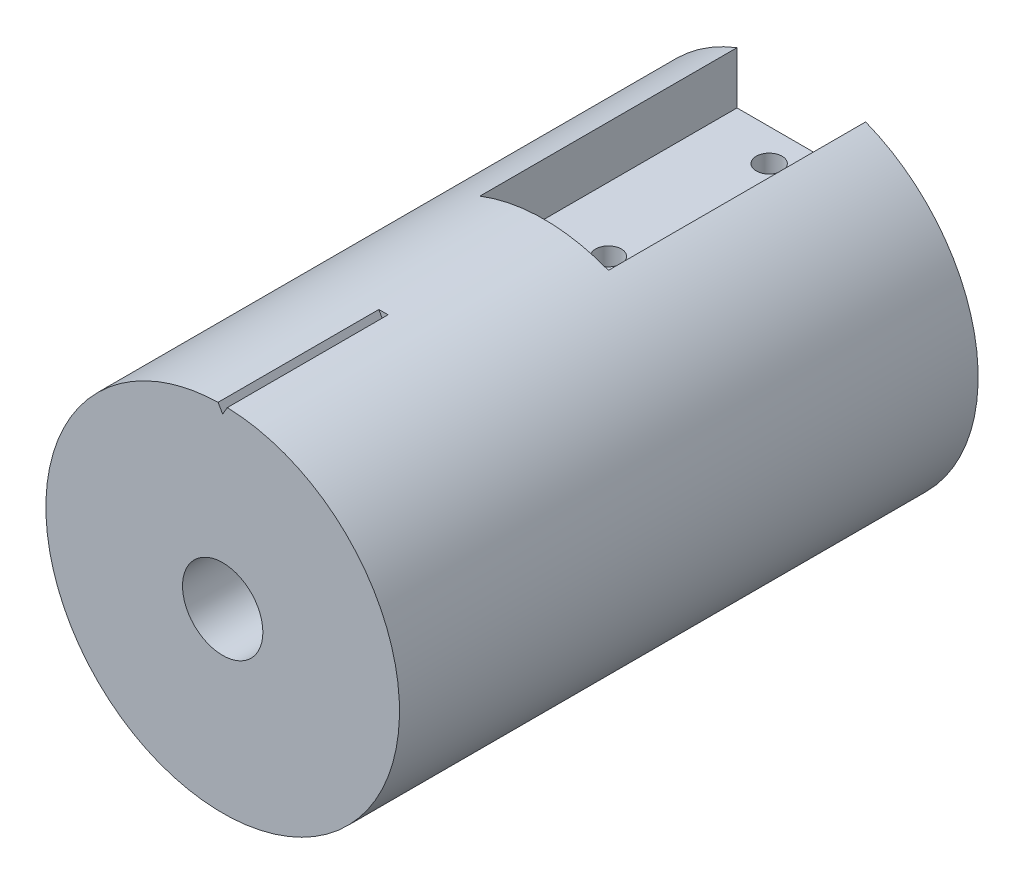
from build123d import *

# Parameters (mm, degrees)
SKETCH1_R             = 11
BOSS_EXTRUDE1_DEPTH   = 36
SKETCH2_W             = 8
SKETCH2_H             = 30
CUT_EXTRUDE1_DEPTH    = 16
CUT_EXTRUDE3_START    = -10
CUT_EXTRUDE3_DEPTH    = 10
M2X0_4_TAPPED_HOLE3_D = 1.6
SKETCH16_R            = 2.5
CUT_EXTRUDE4_DEPTH    = 8


with BuildPart() as part:
    # Sketch1 → Boss-Extrude1 (new body)
    with BuildSketch(Plane.XY):
        Circle(SKETCH1_R)
    extrude(amount=BOSS_EXTRUDE1_DEPTH)

    # Sketch2 → Cut-Extrude1 (cut)
    with BuildSketch(Plane(origin=(0, 0, 0), x_dir=(-1, 0, 0), z_dir=(0, 0, -1))):
        with Locations((0, 22)):
            Rectangle(SKETCH2_W, SKETCH2_H)
    extrude(amount=-CUT_EXTRUDE1_DEPTH, mode=Mode.SUBTRACT)

    # Sketch6 → Cut-Extrude3 (cut)
    with BuildSketch(Plane.XY.offset(36).offset(CUT_EXTRUDE3_START)):
        with BuildLine():
            Line((-0.286520362, 10.996267825), (0, 10.5))
            Line((0, 10.5), (0.286520362, 10.996267825))
            ThreePointArc((0.286520362, 10.996267825), (0, 11), (-0.286520362, 10.996267825))
        make_face()
    extrude(amount=CUT_EXTRUDE3_DEPTH, mode=Mode.SUBTRACT)

    # M2x0.4 Tapped Hole3 (through all)
    with Locations(Plane(origin=(0, 7, 0), x_dir=(1, 0, 0), z_dir=(0, 1, 0))):
        with Locations((0, -12), (0, -2)):
            Hole(M2X0_4_TAPPED_HOLE3_D / 2)

    # Sketch16 → Cut-Extrude4 (cut)
    with BuildSketch(Plane.XY.offset(36)):
        Circle(SKETCH16_R)
    extrude(amount=-CUT_EXTRUDE4_DEPTH, mode=Mode.SUBTRACT)


solid = part.part
